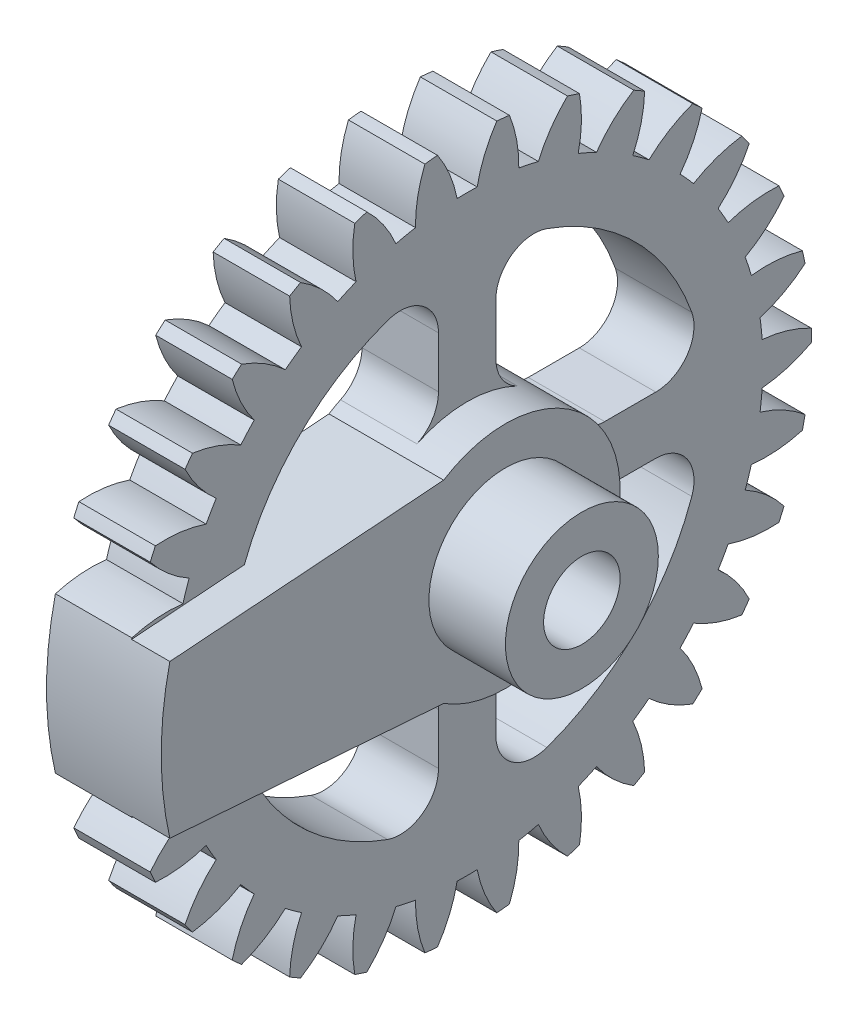
from build123d import *
from build123d.topology import SkipClean

# Parameters (mm, degrees)
BASPROSKE_W              = 4
BASPROSKE_H              = 18
TOOTHCUT_DEPTH           = 26.768197
TEETHCUTS_COUNT          = 30
TEETHCUTS_ANGLE          = 348
BORSKE_R                 = 4
BORE_DEPTH               = 50.000051
BOSS_EXTRUDE1_DEPTH      = 2
BOSS_EXTRUDE1_DEPTH_BACK = 4
CUT_EXTRUDE2_REACH       = 27.721
BOSS_EXTRUDE2_START      = 2
SKETCH6_R                = 4
BOSS_EXTRUDE2_DEPTH      = 4
SKETCH7_R                = 2
CUT_EXTRUDE3_DEPTH       = 28.305497
FILLET1_R                = 2


with BuildPart() as part:
    # BasProSke → Base-Revolve (revolve)
    with BuildSketch(Plane(origin=(0, 0, 0), x_dir=(1, 0, 0), z_dir=(0, 1, 0)), mode=Mode.PRIVATE) as base_revolve_sk:
        with Locations((2, 9)):
            Rectangle(BASPROSKE_W, BASPROSKE_H)
    revolve(base_revolve_sk.sketch.rotate(Axis((-10, 0, 0), (1, 0, 0)), 180), axis=Axis((-10, 0, 0), (1, 0, 0)))

    # TooCutSke → ToothCut (cut, through all)
    with BuildSketch(Plane(origin=(0, 0, 0), x_dir=(0, 0, -1), z_dir=(1, 0, 0))):
        with BuildLine():
            ThreePointArc((0.523522, 15.458888), (0, 15.46775), (-0.523522, 15.458888))
            ThreePointArc((-0.523522, 15.458888), (-0.919551, 16.7609), (-1.568701, 17.95701))
            ThreePointArc((-1.568701, 17.95701), (0, 18.0254), (1.568701, 17.95701))
            ThreePointArc((1.568701, 17.95701), (0.919551, 16.7609), (0.523522, 15.458888))
        make_face()
    toothcut = extrude(amount=TOOTHCUT_DEPTH, mode=Mode.SUBTRACT)

    # TeethCuts: ToothCut ×30 about axis
    teethcuts_axis = Axis((-10, 0, 0), (1, 0, 0))
    for i in range(1, TEETHCUTS_COUNT):
        add(toothcut.rotate(teethcuts_axis, i * TEETHCUTS_ANGLE / (TEETHCUTS_COUNT - 1)), mode=Mode.SUBTRACT)

    # BorSke → Bore (cut, symmetric)
    with BuildSketch(Plane(origin=(0, 0, 0), x_dir=(0, 0, -1), z_dir=(1, 0, 0))):
        with Locations(Location((0, 0, 0), (0, 0, 180))):
            Circle(BORSKE_R)
    extrude(amount=BORE_DEPTH, both=True, mode=Mode.SUBTRACT)

    # Sketch4 → Boss-Extrude1 (add, two sides: drawn at the far end of the back side and taken through both)
    with SkipClean():  # the faces are left unmerged after this step: merging them gives an invalid solid
        with BuildSketch(Plane(origin=(4, 0, 0), x_dir=(0, 0, -1), z_dir=(1, 0, 0)).offset(-BOSS_EXTRUDE1_DEPTH_BACK)):
            with BuildLine():
                Line((-3.227719, 5.057848), (-17.549013, 4.004016))
                ThreePointArc((-17.549013, 4.004016), (-18, 0), (-17.549013, -4.004016))
                Line((-17.549013, -4.004016), (-3.227719, -5.057848))
                ThreePointArc((-3.227719, -5.057848), (6, 0), (-3.227719, 5.057848))
            make_face()
        extrude(amount=BOSS_EXTRUDE1_DEPTH + BOSS_EXTRUDE1_DEPTH_BACK)

    # Sketch1 → Cut-Extrude2 (cut, up to next)
    with BuildSketch(Plane(origin=(4, 0, 0), x_dir=(0, 0, -1), z_dir=(1, 0, 0)), mode=Mode.PRIVATE) as cut_extrude2_sk1:
        with BuildLine():
            Line((-14.21512, 2.243933), (-1.946294, 3.146735))
            ThreePointArc((-1.946294, 3.146735), (3.7, 0), (-1.946294, -3.146735))
            Line((-1.946294, -3.146735), (-14.21512, -2.243933))
            ThreePointArc((-14.21512, -2.243933), (-16.3, 0), (-14.21512, 2.243933))
        make_face()
    cut_extrude2_tool1 = extrude(cut_extrude2_sk1.sketch, amount=-CUT_EXTRUDE2_REACH, mode=Mode.PRIVATE) & part.part
    add(cut_extrude2_tool1.solids().sort_by_distance((4, 0, 5.525518))[0], mode=Mode.SUBTRACT)

    # Sketch6 → Boss-Extrude2 (add)
    with SkipClean():  # the faces are left unmerged after this step: merging them gives an invalid solid
        with BuildSketch(Plane(origin=(4, 0, 0), x_dir=(0, 0, -1), z_dir=(1, 0, 0)).offset(BOSS_EXTRUDE2_START)):
            Circle(SKETCH6_R)
        extrude(amount=BOSS_EXTRUDE2_DEPTH)

    # Sketch7 → Cut-Extrude3 (cut, through all)
    with SkipClean():  # the faces are left unmerged after this step: merging them gives an invalid solid
        with BuildSketch(Plane(origin=(10, 0, 0), x_dir=(0, 0, -1), z_dir=(1, 0, 0))):
            Circle(SKETCH7_R)
            with BuildLine():
                Line((-1.5, 5.809475), (-1.5, 12.377188))
                ThreePointArc((-1.5, 12.377188), (-7.680865, 9.82085), (-11.651131, 4.438012))
                Line((-11.651131, 4.438012), (-3.227719, 5.057848))
                ThreePointArc((-3.227719, 5.057848), (-2.393547, 5.501903), (-1.5, 5.809475))
            make_face()
            with BuildLine():
                Line((1.5, 5.809475), (1.5, 12.377188))
                ThreePointArc((1.5, 12.377188), (8.816031, 8.816031), (12.377188, 1.5))
                Line((12.377188, 1.5), (5.809475, 1.5))
                ThreePointArc((5.809475, 1.5), (4.242641, 4.242641), (1.5, 5.809475))
            make_face()
            with BuildLine():
                Line((1.5, -5.809475), (1.5, -12.377188))
                ThreePointArc((1.5, -12.377188), (8.816031, -8.816031), (12.377188, -1.5))
                Line((12.377188, -1.5), (5.809475, -1.5))
                ThreePointArc((5.809475, -1.5), (4.242641, -4.242641), (1.5, -5.809475))
            make_face()
            with BuildLine():
                Line((-1.5, -5.809475), (-1.5, -12.377188))
                ThreePointArc((-1.5, -12.377188), (-7.680865, -9.82085), (-11.651131, -4.438012))
                Line((-11.651131, -4.438012), (-3.227719, -5.057848))
                ThreePointArc((-3.227719, -5.057848), (-2.393547, -5.501903), (-1.5, -5.809475))
            make_face()
        extrude(amount=-CUT_EXTRUDE3_DEPTH, mode=Mode.SUBTRACT)

    # Fillet1
    fillet1_edges = [part.edges().sort_by_distance(p)[0] for p in [
        (2, -5.809475, 1.5),
        (2, -12.377188, 1.5),
        (2, -1.5, -12.377188),
        (2, -5.809475, -1.5),
        (2, -1.5, -5.809475),
        (2, -12.377188, -1.5),
        (2, 12.377188, -1.5),
        (2, 1.5, -5.809475),
        (2, 5.809475, -1.5),
        (2, 1.5, -12.377188),
        (2, 5.809475, 1.5),
        (2, 12.377188, 1.5),
    ]]
    fillet(fillet1_edges, radius=FILLET1_R)


solid = part.part
